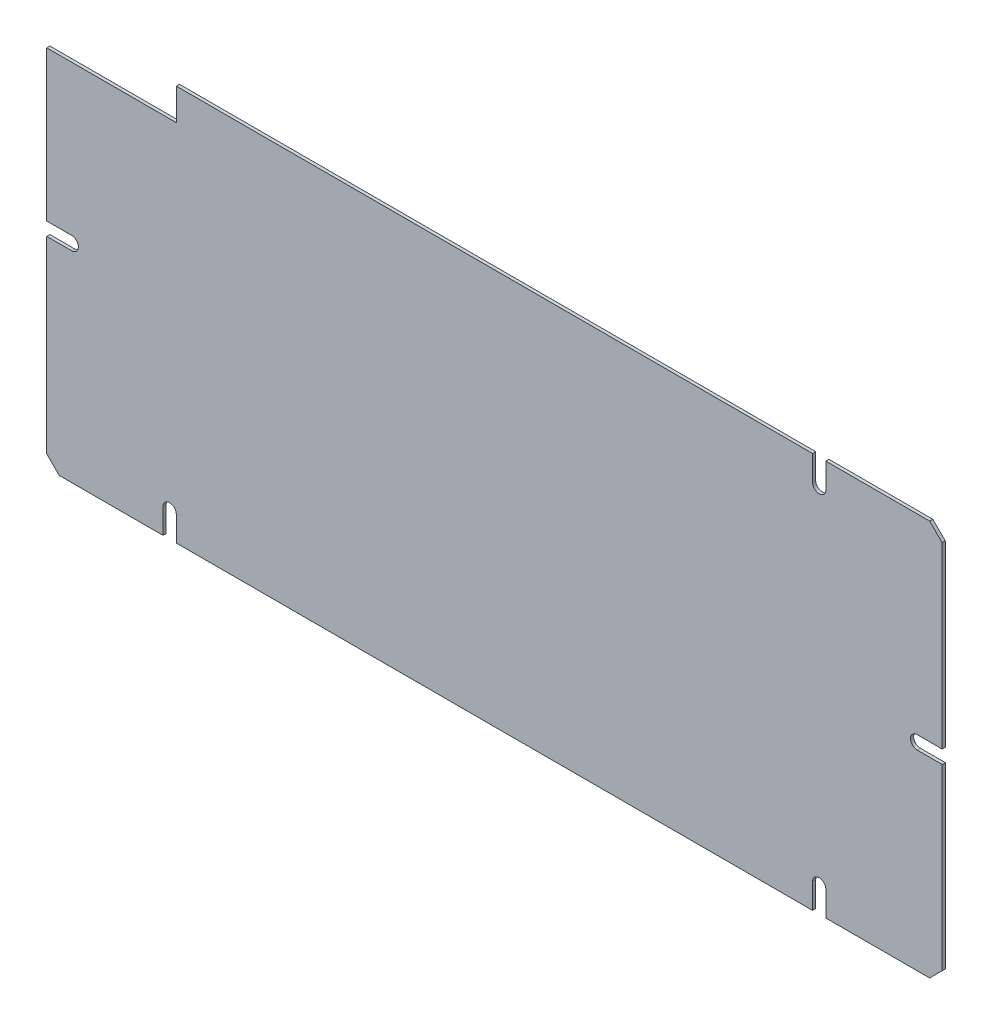
from build123d import *

# Parameters (mm, degrees)
SKETCH1_W               = 455.168
SKETCH1_H               = 201.168
BOSS_EXTRUDE1_DEPTH     = 1.5875
F_1_4_CLEARANCE_HOLE1_D = 6.7564
CUT_EXTRUDE1_REACH      = 250.826
SKETCH6_W               = 6.7564
SKETCH6_H               = 14.478
CUT_EXTRUDE2_REACH      = 250.826
SKETCH7_W               = 12.7
SKETCH7_H               = 6.7564
CUT_EXTRUDE3_DEPTH      = 249.825517719
CHAMFER1_SIZE           = 6.35


with BuildPart() as part:
    # Sketch1 → Boss-Extrude1 (new body)
    with BuildSketch(Plane.XY):
        Rectangle(SKETCH1_W, SKETCH1_H)
    extrude(amount=BOSS_EXTRUDE1_DEPTH)

    # 1/4 Clearance Hole1 (through all)
    with Locations(Plane.XY.offset(1.5875)):
        with Locations((-165.1, 87.884), (165.1, 87.884), (214.884, 0), (-165.1, -87.884), (165.1, -87.884), (-214.884, 4.884)):
            Hole(F_1_4_CLEARANCE_HOLE1_D / 2)

    # Sketch6 → Cut-Extrude1 (cut, up to next)
    with BuildSketch(Plane.XY.offset(1.5875), mode=Mode.PRIVATE) as cut_extrude1_sk1:
        with Locations((-165.1, 95.123)):
            Rectangle(SKETCH6_W, SKETCH6_H)
    cut_extrude1_tool1 = extrude(cut_extrude1_sk1.sketch, amount=-CUT_EXTRUDE1_REACH, mode=Mode.PRIVATE) & part.part
    # Sketch6 → Cut-Extrude1 (cut, up to next)
    with BuildSketch(Plane.XY.offset(1.5875), mode=Mode.PRIVATE) as cut_extrude1_sk2:
        with Locations((165.1, 95.123)):
            Rectangle(SKETCH6_W, SKETCH6_H)
    cut_extrude1_tool2 = extrude(cut_extrude1_sk2.sketch, amount=-CUT_EXTRUDE1_REACH, mode=Mode.PRIVATE) & part.part
    cut_extrude1_1 = cut_extrude1_tool1.solids().sort_by_distance((-165.1, 95.123, 1.5875))[0]
    add(cut_extrude1_1, mode=Mode.SUBTRACT)
    cut_extrude1_2 = cut_extrude1_tool2.solids().sort_by_distance((165.1, 95.123, 1.5875))[0]
    add(cut_extrude1_2, mode=Mode.SUBTRACT)
    cut_extrude1 = cut_extrude1_1 + cut_extrude1_2  # Cut-Extrude1 as one shape, for the pattern or mirror that repeats it

    # Mirror1: Cut-Extrude1 across plane
    add(cut_extrude1.mirror(Plane.ZX), mode=Mode.SUBTRACT)

    # Sketch7 → Cut-Extrude2 (cut, up to next)
    with BuildSketch(Plane.XY.offset(1.5875), mode=Mode.PRIVATE) as cut_extrude2_sk1:
        with Locations((-221.234, 4.884)):
            Rectangle(SKETCH7_W, SKETCH7_H)
    cut_extrude2_tool1 = extrude(cut_extrude2_sk1.sketch, amount=-CUT_EXTRUDE2_REACH, mode=Mode.PRIVATE) & part.part
    # Sketch7 → Cut-Extrude2 (cut, up to next)
    with BuildSketch(Plane.XY.offset(1.5875), mode=Mode.PRIVATE) as cut_extrude2_sk2:
        with Locations((221.234, 0)):
            Rectangle(SKETCH7_W, SKETCH7_H)
    cut_extrude2_tool2 = extrude(cut_extrude2_sk2.sketch, amount=-CUT_EXTRUDE2_REACH, mode=Mode.PRIVATE) & part.part
    add(cut_extrude2_tool1.solids().sort_by_distance((-221.234, 4.884, 1.5875))[0], mode=Mode.SUBTRACT)
    add(cut_extrude2_tool2.solids().sort_by_distance((221.234, 0, 1.5875))[0], mode=Mode.SUBTRACT)

    # Sketch8 → Cut-Extrude3 (cut, through all)
    with BuildSketch(Plane(origin=(0, 0, 0), x_dir=(-1, 0, 0), z_dir=(0, 0, -1))):
        Polygon((168.4782, 100.584), (227.584, 100.584), (227.584, 84.5058), (161.7218, 84.5058), (161.7218, 100.584), align=None)
    extrude(amount=-CUT_EXTRUDE3_DEPTH, mode=Mode.SUBTRACT)

    # Chamfer1
    chamfer1_edges = [part.edges().sort_by_distance(p)[0] for p in [
        (227.584, -100.584, 0.79375),
        (-227.584, -100.584, 0.79375),
        (227.584, 100.584, 0.79375),
    ]]
    chamfer(chamfer1_edges, length=CHAMFER1_SIZE)


solid = part.part
